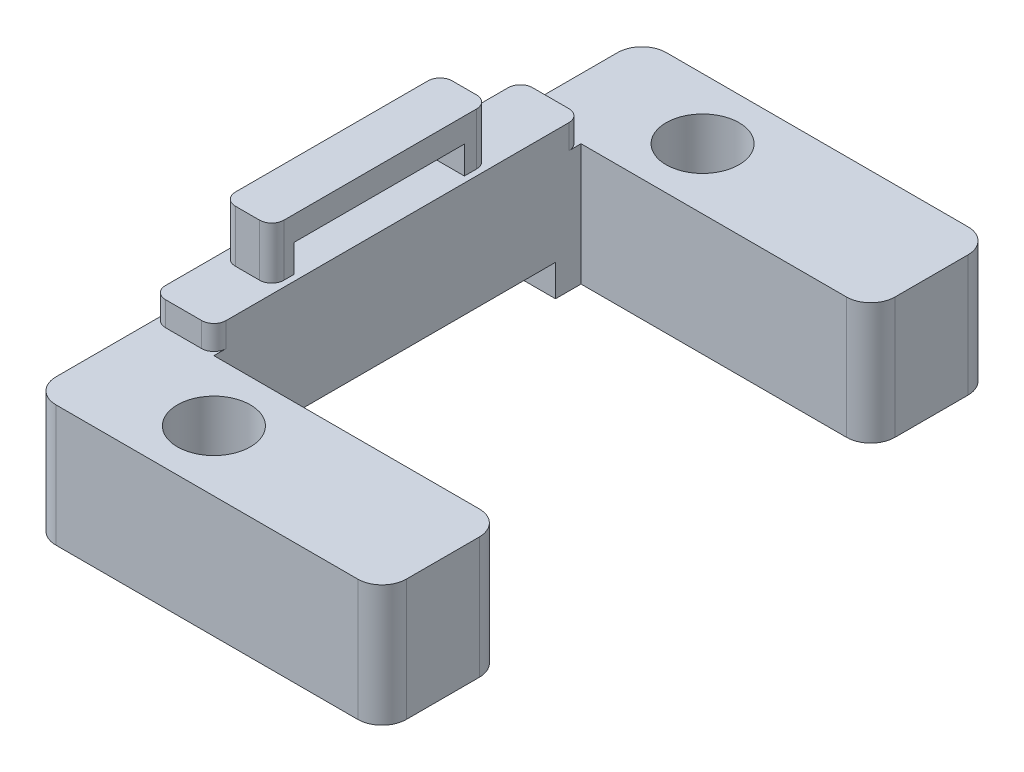
from build123d import *

# Parameters (mm, degrees)
SKETCH1_R           = 1.5
BOSS_EXTRUDE1_DEPTH = 5
SKETCH2_W           = 2.494401268
SKETCH2_H           = 15.1
BOSS_EXTRUDE2_DEPTH = 1
SKETCH3_W           = 13
SKETCH3_H           = 1.3
CUT_EXTRUDE1_DEPTH  = 21.029562163
SKETCH4_W           = 2
SKETCH4_H           = 0.923045376
SKETCH4_H_2         = 1
BOSS_EXTRUDE3_DEPTH = 1.14
SKETCH5_W           = 2
SKETCH5_H           = 8.923045376
BOSS_EXTRUDE4_DEPTH = 1
FILLET1_R           = 1
FILLET2_R           = 0.5


with BuildPart() as part:
    # Sketch1 → Boss-Extrude1 (new body)
    with BuildSketch(Plane(origin=(0, 0, 0), x_dir=(1, 0, 0), z_dir=(0, 1, 0))):
        Polygon((5.958367707, 12.55), (-5.958367707, 12.55), (-8.452768975, 12.55), (-8.452768975, -12.55), (-5.958367707, -12.55), (5.958367707, -12.55), (5.958367707, -7.55), (-5.958367707, -7.55), (-5.958367707, 7.55), (5.958367707, 7.55), align=None)
        with Locations(Location((-3.458367707, -10.05, 0), (0, 0, 270))):
            Circle(SKETCH1_R, mode=Mode.SUBTRACT)
        with Locations(Location((-3.458367707, 10.05, 0), (0, 0, 90))):
            Circle(SKETCH1_R, mode=Mode.SUBTRACT)
    extrude(amount=BOSS_EXTRUDE1_DEPTH)

    # Sketch2 → Boss-Extrude2 (add)
    with BuildSketch(Plane(origin=(0, 5, 0), x_dir=(1, 0, 0), z_dir=(0, 1, 0))):
        with Locations((-7.205568341, 0)):
            Rectangle(SKETCH2_W, SKETCH2_H)
    extrude(amount=BOSS_EXTRUDE2_DEPTH)

    # Sketch3 → Cut-Extrude1 (cut, through all)
    with BuildSketch(Plane.ZY.offset(8.452768975)):
        with Locations((0, 0.65)):
            Rectangle(SKETCH3_W, SKETCH3_H)
    extrude(amount=-CUT_EXTRUDE1_DEPTH, mode=Mode.SUBTRACT)

    # Sketch4 → Boss-Extrude3 (add)
    with BuildSketch(Plane(origin=(0, 6, 0), x_dir=(1, 0, 0), z_dir=(0, 1, 0))):
        with Locations((-7.205568341, -4.461522688)):
            Rectangle(SKETCH4_W, SKETCH4_H)
        with Locations((-7.205568341, 3.5)):
            Rectangle(SKETCH4_W, SKETCH4_H_2)
    extrude(amount=BOSS_EXTRUDE3_DEPTH)

    # Sketch5 → Boss-Extrude4 (add)
    with BuildSketch(Plane(origin=(0, 7.14, 0), x_dir=(1, 0, 0), z_dir=(0, 1, 0))):
        with Locations((-7.205568341, -0.461522688)):
            Rectangle(SKETCH5_W, SKETCH5_H)
    extrude(amount=BOSS_EXTRUDE4_DEPTH)

    # Fillet1
    fillet1_edges = [part.edges().sort_by_distance(p)[0] for p in [
        (5.958367707, 2.5, -7.55),
        (5.958367707, 2.5, 7.55),
        (5.958367707, 2.5, 12.55),
        (-8.452768975, 2.5, 12.55),
        (-8.452768975, 2.5, -12.55),
        (5.958367707, 2.5, -12.55),
    ]]
    fillet(fillet1_edges, radius=FILLET1_R)

    # Fillet2
    fillet2_edges = [part.edges().sort_by_distance(p)[0] for p in [
        (-5.958367707, 5.5, 7.55),
        (-5.958367707, 5.5, -7.55),
        (-8.452768975, 5.5, -7.55),
        (-8.452768975, 5.5, 7.55),
        (-8.205568341, 7.07, 4.923045376),
        (-6.205568341, 7.07, 4.923045376),
        (-6.205568341, 7.07, -4),
        (-8.205568341, 7.07, -4),
    ]]
    fillet(fillet2_edges, radius=FILLET2_R)


solid = part.part
